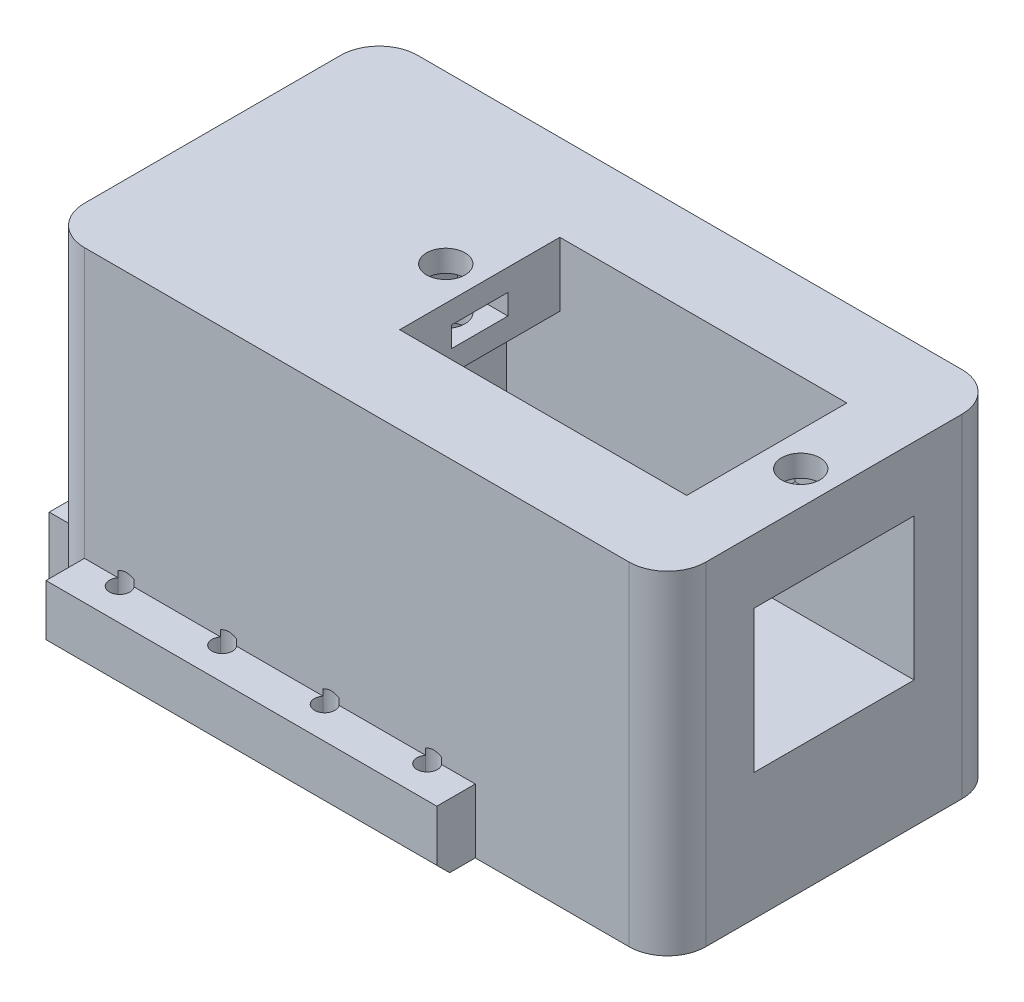
from build123d import *

# Parameters (mm, degrees)
SKETCH_1_W           = 48.5
SKETCH_1_H           = 26
EXTRUDE_1_DEPTH      = 26
SKETCH_16_W          = 22.4
SKETCH_16_H          = 12.5
CUT_EXTRUDE_13_DEPTH = 16.1
SKETCH_17_W          = 12.5
SKETCH_17_H          = 11.1
CUT_EXTRUDE_14_DEPTH = 31.8
CUT_EXTRUDE_15_REACH = 39.856
SKETCH_18_R          = 1.5
SKETCH_20_W          = 7
SKETCH_20_H          = 7
EXTRUDE_2_DEPTH      = 3
CUT_EXTRUDE_16_DEPTH = 43.344568719
FILLET_4_R           = 2
CUT_EXTRUDE_19_DEPTH = 0.8
FILLET_6_R           = 3
SKETCH_28_W          = 30.5
SKETCH_28_H          = 3
EXTRUDE_4_DEPTH      = 5
EXTRUDE_4_2_DEPTH    = 5
EXTRUDE_4_3_DEPTH    = 5
EXTRUDE_4_4_DEPTH    = 5
M2X0_4_1_AT_2_COUNT  = 2
M2X0_4_1_AT_2_PITCH  = 8
M2X0_4_1_AT_3_COUNT  = 2
M2X0_4_1_AT_3_PITCH  = 16
M2X0_4_1_AT_4_COUNT  = 2
M2X0_4_1_AT_4_PITCH  = 24
M2X0_4_1_AT_5_COUNT  = 2
M2X0_4_1_AT_5_PITCH  = 7.477842269
M2X0_4_1_AT_6_COUNT  = 2
M2X0_4_1_AT_6_PITCH  = 22.301751613
M2X0_4_1_AT_7_COUNT  = 2
M2X0_4_1_AT_7_PITCH  = 27
M2X0_4_1_AT_8_COUNT  = 2
M2X0_4_1_AT_8_PITCH  = 28.160255681
M2X0_4_1_AT_9_COUNT  = 2
M2X0_4_1_AT_9_PITCH  = 31.384709653
M2X0_4_1_AT_10_COUNT = 2
M2X0_4_1_AT_10_PITCH = 36.124783736
CHAMFER_1_SIZE       = 1
CHAMFER_2_SIZE       = 1
SKETCH_23_R          = 4
CUT_EXTRUDE_33_DEPTH = 4
CUT_EXTRUDE_34_DEPTH = 1.6


with BuildPart() as part:
    # 草图1 → 凸台-拉伸1 (new body)
    with BuildSketch(Plane(origin=(0, 0, 0), x_dir=(1, 0, 0), z_dir=(0, 1, 0))):
        Rectangle(SKETCH_1_W, SKETCH_1_H)
    extrude(amount=EXTRUDE_1_DEPTH)

    # 草图16 → 切除-拉伸13 (cut)
    with BuildSketch(Plane(origin=(0, 26, 0), x_dir=(1, 0, 0), z_dir=(0, 1, 0))):
        with Locations((7.8, 0)):
            Rectangle(SKETCH_16_W, SKETCH_16_H)
    extrude(amount=-CUT_EXTRUDE_13_DEPTH, mode=Mode.SUBTRACT)

    # 草图17 → 切除-拉伸14 (cut)
    with BuildSketch(Plane(origin=(24.25, 0, 0), x_dir=(0, 0, -1), z_dir=(1, 0, 0))):
        with Locations((0, 15.45)):
            Rectangle(SKETCH_17_W, SKETCH_17_H)
    extrude(amount=-CUT_EXTRUDE_14_DEPTH, mode=Mode.SUBTRACT)

    # 草图18 → 切除-拉伸15 (cut, up to next)
    with BuildSketch(Plane(origin=(0, 26, 0), x_dir=(1, 0, 0), z_dir=(0, 1, 0)), mode=Mode.PRIVATE) as cut_extrude_15_sk1:
        with Locations(Location((21.65, 0, 0), (0, 0, 270))):
            Circle(SKETCH_18_R)
    cut_extrude_15_tool1 = extrude(cut_extrude_15_sk1.sketch, amount=-CUT_EXTRUDE_15_REACH, mode=Mode.PRIVATE) & part.part
    # 草图18 → 切除-拉伸15 (cut, up to next)
    with BuildSketch(Plane(origin=(0, 26, 0), x_dir=(1, 0, 0), z_dir=(0, 1, 0)), mode=Mode.PRIVATE) as cut_extrude_15_sk2:
        with Locations(Location((-6.05, 0, 0), (0, 0, 180))):
            Circle(SKETCH_18_R)
    cut_extrude_15_tool2 = extrude(cut_extrude_15_sk2.sketch, amount=-CUT_EXTRUDE_15_REACH, mode=Mode.PRIVATE) & part.part
    add(cut_extrude_15_tool1.solids().sort_by_distance((21.65, 26, 0))[0], mode=Mode.SUBTRACT)
    add(cut_extrude_15_tool2.solids().sort_by_distance((-6.05, 26, 0))[0], mode=Mode.SUBTRACT)

    # 草图20 → 凸台-拉伸2 (add)
    with BuildSketch(Plane.XZ):
        with Locations((-16.25, -6.5)):
            Rectangle(SKETCH_20_W, SKETCH_20_H)
        with Locations((-16.25, 6.5)):
            Rectangle(SKETCH_20_W, SKETCH_20_H)
    extrude(amount=EXTRUDE_2_DEPTH)

    # 草图21 → 切除-拉伸16 (cut, through all)
    with BuildSketch(Plane(origin=(0, 0, -10), x_dir=(-1, 0, 0), z_dir=(0, 0, -1))):
        Polygon((12.75, 0), (16.5, -3), (12.75, -3), align=None)
    extrude(amount=-CUT_EXTRUDE_16_DEPTH, mode=Mode.SUBTRACT)

    # 圆角4
    fillet_4_edges = [part.edges().sort_by_distance(p)[0] for p in [
        (-16.5, -3, 6.5),
        (-16.5, -3, -6.5),
    ]]
    fillet(fillet_4_edges, radius=FILLET_4_R)

    # 草图27 → 切除-拉伸19 (cut, symmetric)
    with BuildSketch(Plane(origin=(0, 23.5, 0), x_dir=(1, 0, 0), z_dir=(0, 1, 0))):
        Polygon((-3.4, 2.2), (-3.4, -2.2), (-4.895299462, -2.2), (-7.320170592, -2.2), (-8.590341184, 0), (-7.320170592, 2.2), (-4.895299462, 2.2), align=None)
        Polygon((19, 2.2), (19, -2.2), (20.495299462, -2.2), (22.920170592, -2.2), (24.190341184, 0), (22.920170592, 2.2), (20.495299462, 2.2), align=None)
    extrude(amount=CUT_EXTRUDE_19_DEPTH, both=True, mode=Mode.SUBTRACT)

    # 圆角6
    fillet_6_edges = [part.edges().sort_by_distance(p)[0] for p in [
        (24.25, 13, 13),
        (-24.25, 13, 13),
        (-24.25, 13, -13),
        (24.25, 13, -13),
    ]]
    fillet(fillet_6_edges, radius=FILLET_6_R)


with BuildPart() as body_2:
    # 草图28 → 凸台-拉伸4 (new body)
    with BuildSketch(Plane.XZ):
        with Locations((-6, 14.5)):
            Rectangle(SKETCH_28_W, SKETCH_28_H)
    extrude(amount=-EXTRUDE_4_DEPTH)


with BuildPart() as body_3:
    # 草图28 → Extrude 4 2 (new body)
    with BuildSketch(Plane.XZ):
        with BuildLine():
            Line((-24.25, 4.75), (-25.75, 4.75))
            Line((-25.75, 4.75), (-25.75, 11.25))
            Line((-25.75, 11.25), (-23.977178029, 11.25))
            ThreePointArc((-23.977178029, 11.25), (-24.181001031, 10.639713183), (-24.25, 10))
            Line((-24.25, 10), (-24.25, 4.75))
        make_face()
    extrude(amount=-EXTRUDE_4_2_DEPTH)


with BuildPart() as body_4:
    # 草图28 → Extrude 4 3 (new body)
    with BuildSketch(Plane.XZ):
        with BuildLine():
            Line((-24.25, -10), (-24.25, -4.75))
            Line((-24.25, -4.75), (-25.75, -4.75))
            Line((-25.75, -4.75), (-25.75, -11.25))
            Line((-25.75, -11.25), (-23.977178029, -11.25))
            ThreePointArc((-23.977178029, -11.25), (-24.181001031, -10.639713183), (-24.25, -10))
        make_face()
    extrude(amount=-EXTRUDE_4_3_DEPTH)


with BuildPart() as body_5:
    # 草图28 → Extrude 4 4 (new body)
    with BuildSketch(Plane.XZ):
        with Locations((-6, -14.5)):
            Rectangle(SKETCH_28_W, SKETCH_28_H)
    extrude(amount=-EXTRUDE_4_4_DEPTH)


with BuildPart() as m2x0_4_1_tool:
    # 草图32 → M2x0.4 螺纹孔1 (revolve)
    with BuildSketch(Plane(origin=(-18, 0, -13.5), x_dir=(0, 0, -1), z_dir=(1, 0, 0))):
        Polygon((0, 0), (0, 5.980688495), (0.8, 5.5), (0.8, 0), align=None)
    m2x0_4_1 = revolve(axis=Axis((-18, -6.35, -13.5), (0, 1, 0)))


with BuildPart() as part_1:
    add(part.part)

    # M2x0.4 螺纹孔1: cut by m2x0_4_1_tool
    add(m2x0_4_1_tool.part, mode=Mode.SUBTRACT)


with BuildPart() as body_5_1:
    add(body_5.part)

    # M2x0.4 螺纹孔1: cut by m2x0_4_1_tool
    add(m2x0_4_1_tool.part, mode=Mode.SUBTRACT)


with BuildPart() as m2x0_4_1_at_2_tool:
    # M2x0.4 螺纹孔1 at 2: M2x0.4 螺纹孔1 ×2
    with Locations(*[(i * M2X0_4_1_AT_2_PITCH, 0, 0) for i in range(1, M2X0_4_1_AT_2_COUNT)]):
        add(m2x0_4_1)


with BuildPart() as part_2:
    add(part_1.part)

    # M2x0.4 螺纹孔1 at 2: cut by m2x0_4_1_at_2_tool
    add(m2x0_4_1_at_2_tool.part, mode=Mode.SUBTRACT)


with BuildPart() as body_5_2:
    add(body_5_1.part)

    # M2x0.4 螺纹孔1 at 2: cut by m2x0_4_1_at_2_tool
    add(m2x0_4_1_at_2_tool.part, mode=Mode.SUBTRACT)


with BuildPart() as m2x0_4_1_at_3_tool:
    # M2x0.4 螺纹孔1 at 3: M2x0.4 螺纹孔1 ×2
    with Locations(*[(i * M2X0_4_1_AT_3_PITCH, 0, 0) for i in range(1, M2X0_4_1_AT_3_COUNT)]):
        add(m2x0_4_1)


with BuildPart() as part_3:
    add(part_2.part)

    # M2x0.4 螺纹孔1 at 3: cut by m2x0_4_1_at_3_tool
    add(m2x0_4_1_at_3_tool.part, mode=Mode.SUBTRACT)


with BuildPart() as body_5_3:
    add(body_5_2.part)

    # M2x0.4 螺纹孔1 at 3: cut by m2x0_4_1_at_3_tool
    add(m2x0_4_1_at_3_tool.part, mode=Mode.SUBTRACT)


with BuildPart() as m2x0_4_1_at_4_tool:
    # M2x0.4 螺纹孔1 at 4: M2x0.4 螺纹孔1 ×2
    with Locations(*[(i * M2X0_4_1_AT_4_PITCH, 0, 0) for i in range(1, M2X0_4_1_AT_4_COUNT)]):
        add(m2x0_4_1)


with BuildPart() as part_4:
    add(part_3.part)

    # M2x0.4 螺纹孔1 at 4: cut by m2x0_4_1_at_4_tool
    add(m2x0_4_1_at_4_tool.part, mode=Mode.SUBTRACT)

    # M2x0.4 螺纹孔1 at 5: M2x0.4 螺纹孔1 ×2
    with Locations(*[Vector(-0.7020741827848285, 0, 0.7121038139674688) * (i * M2X0_4_1_AT_5_PITCH) for i in range(1, M2X0_4_1_AT_5_COUNT)]):
        add(m2x0_4_1, mode=Mode.SUBTRACT)

    # M2x0.4 螺纹孔1 at 6: M2x0.4 螺纹孔1 ×2
    with Locations(*[Vector(-0.2354075182588642, 0, 0.971896753954453) * (i * M2X0_4_1_AT_6_PITCH) for i in range(1, M2X0_4_1_AT_6_COUNT)]):
        add(m2x0_4_1, mode=Mode.SUBTRACT)


with BuildPart() as body_5_4:
    add(body_5_3.part)

    # M2x0.4 螺纹孔1 at 4: cut by m2x0_4_1_at_4_tool
    add(m2x0_4_1_at_4_tool.part, mode=Mode.SUBTRACT)

    # 倒角2
    chamfer_2_edges = [body_5_4.edges().sort_by_distance(p)[0] for p in [
        (-6, 0, -16),
    ]]
    chamfer(chamfer_2_edges, length=CHAMFER_2_SIZE)


with BuildPart() as m2x0_4_1_at_7_tool:
    # M2x0.4 螺纹孔1 at 7: M2x0.4 螺纹孔1 ×2
    with Locations(*[(0, 0, i * M2X0_4_1_AT_7_PITCH) for i in range(1, M2X0_4_1_AT_7_COUNT)]):
        add(m2x0_4_1)


with BuildPart() as part_5:
    add(part_4.part)

    # M2x0.4 螺纹孔1 at 7: cut by m2x0_4_1_at_7_tool
    add(m2x0_4_1_at_7_tool.part, mode=Mode.SUBTRACT)


with BuildPart() as body_2_1:
    add(body_2.part)

    # M2x0.4 螺纹孔1 at 7: cut by m2x0_4_1_at_7_tool
    add(m2x0_4_1_at_7_tool.part, mode=Mode.SUBTRACT)


with BuildPart() as m2x0_4_1_at_8_tool:
    # M2x0.4 螺纹孔1 at 8: M2x0.4 螺纹孔1 ×2
    with Locations(*[Vector(0.28408832969137404, 0, 0.9587981127083872) * (i * M2X0_4_1_AT_8_PITCH) for i in range(1, M2X0_4_1_AT_8_COUNT)]):
        add(m2x0_4_1)


with BuildPart() as part_6:
    add(part_5.part)

    # M2x0.4 螺纹孔1 at 8: cut by m2x0_4_1_at_8_tool
    add(m2x0_4_1_at_8_tool.part, mode=Mode.SUBTRACT)


with BuildPart() as body_2_2:
    add(body_2_1.part)

    # M2x0.4 螺纹孔1 at 8: cut by m2x0_4_1_at_8_tool
    add(m2x0_4_1_at_8_tool.part, mode=Mode.SUBTRACT)


with BuildPart() as m2x0_4_1_at_9_tool:
    # M2x0.4 螺纹孔1 at 9: M2x0.4 螺纹孔1 ×2
    with Locations(*[Vector(0.5098023903017329, 0, 0.8602915336341743) * (i * M2X0_4_1_AT_9_PITCH) for i in range(1, M2X0_4_1_AT_9_COUNT)]):
        add(m2x0_4_1)


with BuildPart() as part_7:
    add(part_6.part)

    # M2x0.4 螺纹孔1 at 9: cut by m2x0_4_1_at_9_tool
    add(m2x0_4_1_at_9_tool.part, mode=Mode.SUBTRACT)


with BuildPart() as body_2_3:
    add(body_2_2.part)

    # M2x0.4 螺纹孔1 at 9: cut by m2x0_4_1_at_9_tool
    add(m2x0_4_1_at_9_tool.part, mode=Mode.SUBTRACT)


with BuildPart() as m2x0_4_1_at_10_tool:
    # M2x0.4 螺纹孔1 at 10: M2x0.4 螺纹孔1 ×2
    with Locations(*[Vector(0.6643638388299198, 0, 0.7474093186836598) * (i * M2X0_4_1_AT_10_PITCH) for i in range(1, M2X0_4_1_AT_10_COUNT)]):
        add(m2x0_4_1)


with BuildPart() as part_8:
    add(part_7.part)

    # M2x0.4 螺纹孔1 at 10: cut by m2x0_4_1_at_10_tool
    add(m2x0_4_1_at_10_tool.part, mode=Mode.SUBTRACT)

    # 草图23 → 切除-拉伸33 (cut)
    with BuildSketch(Plane.XZ):
        with Locations(Location((12.75, 0, 0), (0, 0, 270))):
            Circle(SKETCH_23_R)
    extrude(amount=-CUT_EXTRUDE_33_DEPTH, mode=Mode.SUBTRACT)

    # 草图47 → 切除-拉伸34 (cut)
    with BuildSketch(Plane.XZ.offset(-4)):
        Polygon((15.059401077, 0), (13.904700538, 2), (11.595299462, 2), (10.440598923, 0), (11.595299462, -2), (13.904700538, -2), align=None)
    extrude(amount=-CUT_EXTRUDE_34_DEPTH, mode=Mode.SUBTRACT)


with BuildPart() as body_2_4:
    add(body_2_3.part)

    # M2x0.4 螺纹孔1 at 10: cut by m2x0_4_1_at_10_tool
    add(m2x0_4_1_at_10_tool.part, mode=Mode.SUBTRACT)

    # 倒角1
    chamfer_1_edges = [body_2_4.edges().sort_by_distance(p)[0] for p in [
        (-6, 0, 16),
    ]]
    chamfer(chamfer_1_edges, length=CHAMFER_1_SIZE)


solid = Compound([body_3.part, body_4.part, body_5_4.part, part_8.part, body_2_4.part])
